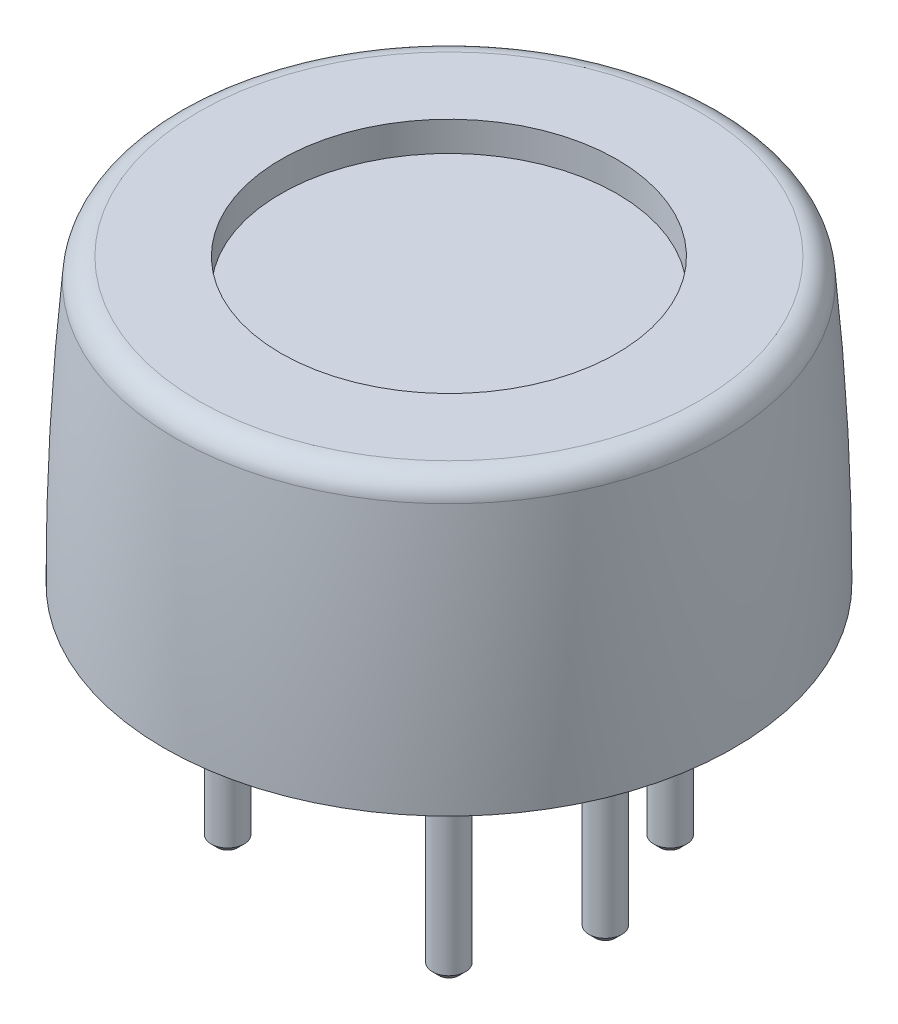
from build123d import *

# Parameters (mm, degrees)
EXTRUDE_1_DEPTH = 1.2
SKETCH_3_R      = 0.5
EXTRUDE_2_DEPTH = 5.8
CHAMFER_1_SIZE  = 0.2


with BuildPart() as part:
    # Эскиз1 → Повернуть1 (revolve)
    with BuildSketch(Plane(origin=(0, 0, 0), x_dir=(0, 0, -1), z_dir=(1, 0, 0))):
        with BuildLine():
            Line((0, 1.2), (-7.05, 1.2))
            Line((-7.05, 1.2), (-7.25, 1.4))
            Line((-7.25, 1.4), (-7.65, 1))
            Line((-7.65, 1), (-8.65, 1))
            ThreePointArc((-8.65, 1), (-8.561771126, 4.984856949), (-8.297257426, 8.96190381))
            ThreePointArc((-8.297257426, 8.96190381), (-8.072581915, 9.416397457), (-7.6, 9.6))
            Line((-7.6, 9.6), (-5.1, 9.6))
            Line((-5.1, 9.6), (-5.1, 8.7))
            Line((-5.1, 8.7), (0, 8.7))
            Line((0, 8.7), (0, 1.2))
        make_face()
    revolve(axis=Axis((0, 8.7, 0), (0, -1, 0)))

    # Эскиз2 → Бобышка-Вытянуть1 (add)
    with BuildSketch(Plane.XZ.offset(-1.2)):
        with BuildLine():
            ThreePointArc((-2.368807717, 2.368807717), (-2.368807717, 4.384062043), (-4.384062043, 4.384062043))
            ThreePointArc((-4.384062043, 4.384062043), (-6.2, 0), (-4.384062043, -4.384062043))
            ThreePointArc((-4.384062043, -4.384062043), (-2.368807717, -4.384062043), (-2.368807717, -2.368807717))
            ThreePointArc((-2.368807717, -2.368807717), (-3.35, 0), (-2.368807717, 2.368807717))
        make_face()
        with BuildLine():
            ThreePointArc((4.384062043, -4.384062043), (5.728053102, -2.372637281), (6.2, 0))
            ThreePointArc((6.2, 0), (5.728053102, 2.372637281), (4.384062043, 4.384062043))
            ThreePointArc((4.384062043, 4.384062043), (2.368807717, 4.384062043), (2.368807717, 2.368807717))
            ThreePointArc((2.368807717, 2.368807717), (3.094996434, 1.281989498), (3.35, 0))
            ThreePointArc((3.35, 0), (3.094996434, -1.281989498), (2.368807717, -2.368807717))
            ThreePointArc((2.368807717, -2.368807717), (2.368807717, -4.384062043), (4.384062043, -4.384062043))
        make_face()
    extrude(amount=EXTRUDE_1_DEPTH)

    # Эскиз3 → Бобышка-Вытянуть2 (add)
    with BuildSketch(Plane.XZ):
        with Locations(Location((-4.75, 0, 0), (0, 0, 270))):
            Circle(SKETCH_3_R)
        with Locations(Location((-3.358757211, 3.358757211, 0), (0, 0, 270))):
            Circle(SKETCH_3_R)
        with Locations(Location((-3.358757211, -3.358757211, 0), (0, 0, 270))):
            Circle(SKETCH_3_R)
        with Locations(Location((3.358757211, 3.358757211, 0), (0, 0, 90))):
            Circle(SKETCH_3_R)
        with Locations(Location((4.75, 0, 0), (0, 0, 90))):
            Circle(SKETCH_3_R)
        with Locations(Location((3.358757211, -3.358757211, 0), (0, 0, 90))):
            Circle(SKETCH_3_R)
    extrude(amount=EXTRUDE_2_DEPTH)

    # Фаска1
    chamfer_1_edges = [part.edges().sort_by_distance(p)[0] for p in [
        (-4.75, -5.8, 0.5),
        (-3.358757211, -5.8, 3.858757211),
        (-3.358757211, -5.8, -2.858757211),
        (3.358757211, -5.8, 2.858757211),
        (4.75, -5.8, -0.5),
        (3.358757211, -5.8, -3.858757211),
    ]]
    chamfer(chamfer_1_edges, length=CHAMFER_1_SIZE)


solid = part.part
